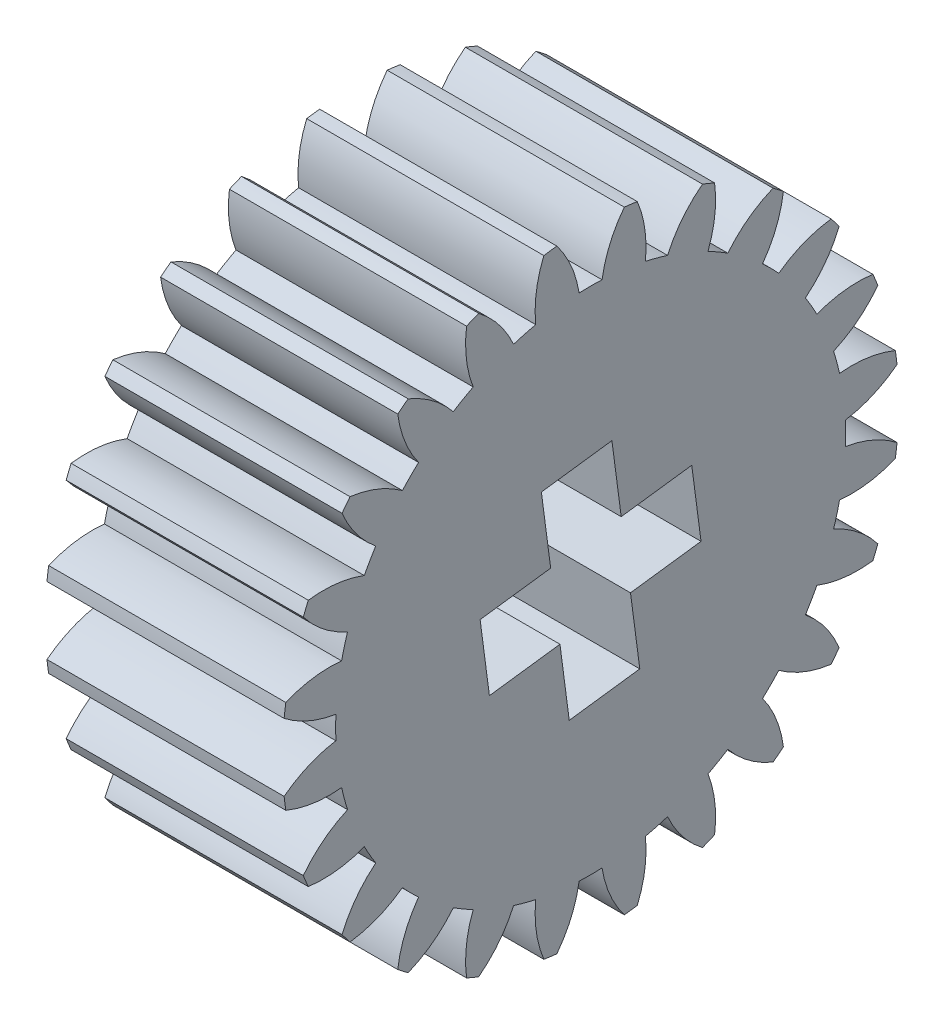
from build123d import *

# Parameters (mm, degrees)
BASPROSKE_W        = 10
BASPROSKE_H        = 13
TOOTHCUT_DEPTH     = 21.928449536
TEETHCUTS_COUNT    = 24
TEETHCUTS_ANGLE    = 345
BORSKE_R           = 0.5
BORE_DEPTH         = 50.0000508
CUT_EXTRUDE1_DEPTH = 21.83151436


with BuildPart() as part:
    # BasProSke → Base-Revolve (revolve)
    with BuildSketch(Plane(origin=(0, 0, 0), x_dir=(1, 0, 0), z_dir=(0, 1, 0)), mode=Mode.PRIVATE) as base_revolve_sk:
        with Locations((5, 6.5)):
            Rectangle(BASPROSKE_W, BASPROSKE_H)
    revolve(base_revolve_sk.sketch.rotate(Axis((-10, 0, 0), (1, 0, 0)), 180), axis=Axis((-10, 0, 0), (1, 0, 0)))

    # TooCutSke → ToothCut (cut, through all)
    with BuildSketch(Plane(origin=(0, 0, 0), x_dir=(0, 0, -1), z_dir=(1, 0, 0))):
        with BuildLine():
            ThreePointArc((0.483448384, 10.738122679), (0, 10.749), (-0.483448384, 10.738122679))
            ThreePointArc((-0.483448384, 10.738122679), (-0.821636462, 11.902754369), (-1.44092227, 12.945454344))
            ThreePointArc((-1.44092227, 12.945454344), (0, 13.0254), (1.44092227, 12.945454344))
            ThreePointArc((1.44092227, 12.945454344), (0.821636462, 11.902754369), (0.483448384, 10.738122679))
        make_face()
    toothcut = extrude(amount=TOOTHCUT_DEPTH, mode=Mode.SUBTRACT)

    # TeethCuts: ToothCut ×24 about axis
    teethcuts_axis = Axis((-10, 0, 0), (1, 0, 0))
    for i in range(1, TEETHCUTS_COUNT):
        add(toothcut.rotate(teethcuts_axis, i * TEETHCUTS_ANGLE / (TEETHCUTS_COUNT - 1)), mode=Mode.SUBTRACT)

    # BorSke → Bore (cut, symmetric)
    with BuildSketch(Plane(origin=(0, 0, 0), x_dir=(0, 0, -1), z_dir=(1, 0, 0))):
        with Locations(Location((0, 0, 0), (0, 0, 180))):
            Circle(BORSKE_R)
    extrude(amount=BORE_DEPTH, both=True, mode=Mode.SUBTRACT)

    # Sketch1 → Cut-Extrude1 (cut, through all)
    with BuildSketch(Plane(origin=(10, 0, 0), x_dir=(0, 0, -1), z_dir=(1, 0, 0))):
        Polygon((1.68295658, -1.291378004), (4.657291165, -0.899799427), (4.265712588, 2.074535157), (1.291378004, 1.68295658), (0.899799427, 4.657291165), (-2.074535157, 4.265712588), (-1.68295658, 1.291378004), (-4.657291165, 0.899799427), (-4.265712588, -2.074535157), (-1.291378004, -1.68295658), (-0.899799427, -4.657291165), (2.074535157, -4.265712588), align=None)
    extrude(amount=-CUT_EXTRUDE1_DEPTH, mode=Mode.SUBTRACT)


solid = part.part
